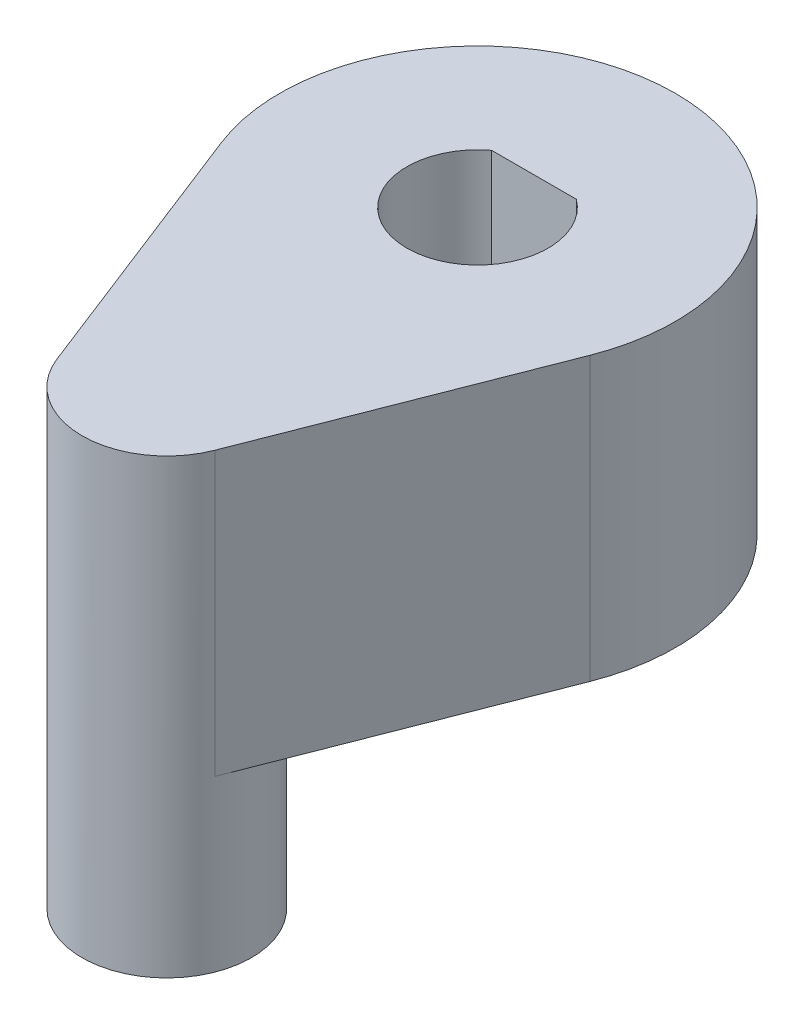
from build123d import *

# Parameters (mm, degrees)
SKETCH1_R                = 7
BOSS_EXTRUDE1_DEPTH      = 10
SKETCH3_W                = 5.7
SKETCH3_H                = 2.5
CUT_EXTRUDE1_DEPTH       = 8
SKETCH6_R                = 1.55
CUT_EXTRUDE2_DEPTH       = 15.071247279
BOSS_EXTRUDE2_DEPTH      = 6
BOSS_EXTRUDE2_DEPTH_BACK = 10
SKETCH7_R                = 3
BOSS_EXTRUDE3_START      = -10
BOSS_EXTRUDE3_DEPTH      = 10


with BuildPart() as part:
    # Sketch1 → Boss-Extrude1 (new body)
    with BuildSketch(Plane(origin=(0, 0, 0), x_dir=(1, 0, 0), z_dir=(0, 1, 0))):
        with Locations(Location((0, 0, 0), (0, 0, 270))):
            Circle(SKETCH1_R)
        with BuildLine():
            Line((-1.5, 2), (1.5, 2))
            ThreePointArc((1.5, 2), (0, -2.5), (-1.5, 2))
        make_face(mode=Mode.SUBTRACT)
    extrude(amount=BOSS_EXTRUDE1_DEPTH)

    # Sketch3 → Cut-Extrude1 (cut)
    with BuildSketch(Plane(origin=(0, 0, 0), x_dir=(1, 0, 0), z_dir=(0, 1, 0))):
        with Locations((0, 4)):
            Rectangle(SKETCH3_W, SKETCH3_H)
    extrude(amount=CUT_EXTRUDE1_DEPTH, mode=Mode.SUBTRACT)

    # Sketch6 → Cut-Extrude2 (cut, through all)
    with BuildSketch(Plane.XY):
        with Locations(Location((0, 5, 0), (0, 0, 345.407449398))):
            Circle(SKETCH6_R)
    extrude(amount=-CUT_EXTRUDE2_DEPTH, mode=Mode.SUBTRACT)



with BuildPart() as body_2:
    # Sketch7 → Boss-Extrude2 (new, two sides: drawn at the far end of the back side and taken through both)
    with BuildSketch(Plane.XZ.offset(-BOSS_EXTRUDE2_DEPTH_BACK)):
        with Locations(Location((0, 11, 0), (0, 0, 270))):
            Circle(SKETCH7_R)
    extrude(amount=BOSS_EXTRUDE2_DEPTH + BOSS_EXTRUDE2_DEPTH_BACK)


with BuildPart() as part_1:
    add(part.part)

    add(body_2.part)  # Boss-Extrude3 merges body 2
    # Sketch9 → Boss-Extrude3 (add)
    with BuildSketch(Plane(origin=(0, 10, 0), x_dir=(1, 0, 0), z_dir=(0, 1, 0)).offset(BOSS_EXTRUDE3_START)):
        with BuildLine():
            ThreePointArc((6.520786851, -2.545454545), (0, -7), (-6.520786851, -2.545454545))
            Line((-6.520786851, -2.545454545), (-2.794622936, -12.090909091))
            ThreePointArc((-2.794622936, -12.090909091), (-0.555036572, -8.051791323), (3, -11))
            ThreePointArc((3, -11), (2.948208677, -11.555036572), (2.794622936, -12.090909091))
            Line((2.794622936, -12.090909091), (6.520786851, -2.545454545))
        make_face()
    extrude(amount=BOSS_EXTRUDE3_DEPTH)


solid = part_1.part
